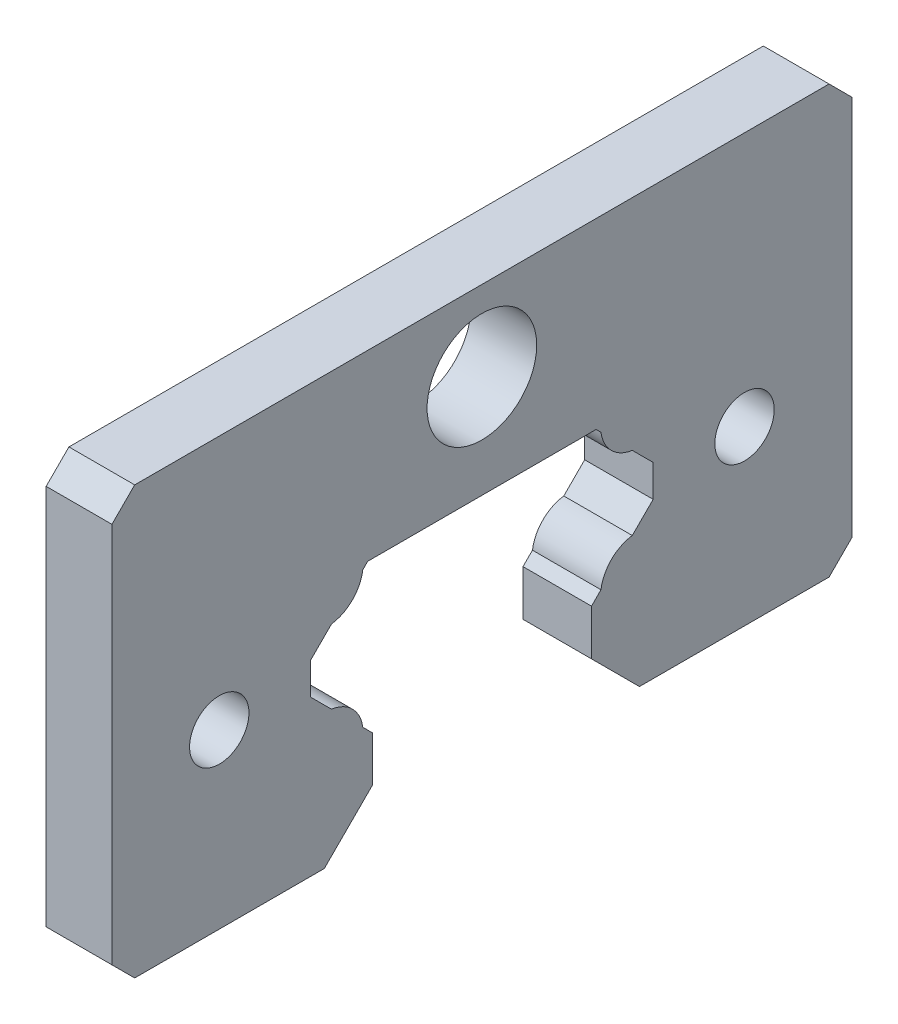
from build123d import *

# Parameters (mm, degrees)
EXTRUDE_1_DEPTH          = 1.5
EXTRUDE_1_DEPTH_BACK     = 1.5
CUT_EXTRUDE_1_DEPTH      = 1.5
CUT_EXTRUDE_1_DEPTH_BACK = 1.5
CUT_EXTRUDE_2_DEPTH      = 0.12
SKETCH_4_R               = 2.4
CUT_EXTRUDE_3_DEPTH      = 3
CUT_EXTRUDE_4_DEPTH      = 3
CUT_EXTRUDE_4_DEPTH_BACK = 3
SKETCH_5_R               = 1.3
CUT_EXTRUDE_5_DEPTH      = 3
CUT_EXTRUDE_5_DEPTH_BACK = 3
SKETCH_6_R               = 1.3


with BuildPart() as part:
    # Эскиз1 → Бобышка-Вытянуть1 (new, two sides: drawn at the far end of the back side and taken through both)
    with BuildSketch(Plane(origin=(0, 0, 0), x_dir=(0, 0, -1), z_dir=(1, 0, 0)).offset(-EXTRUDE_1_DEPTH_BACK)):
        Polygon((-16.2, 0.997020561), (-15.202979439, 0), (15.202979439, 0), (16.2, 0.997020561), (16.2, 17.702979439), (15.202979439, 18.7), (-15.202979439, 18.7), (-16.2, 17.702979439), align=None)
    extrude(amount=EXTRUDE_1_DEPTH + EXTRUDE_1_DEPTH_BACK)

    # Эскиз2 → Вырез-Вытянуть1 (cut, two sides: drawn at the far end of the back side and taken through both)
    with BuildSketch(Plane(origin=(0, 0, 0), x_dir=(0, 0, -1), z_dir=(1, 0, 0)).offset(-CUT_EXTRUDE_1_DEPTH_BACK)):
        with BuildLine():
            Line((-11.2, -4.3), (11.2, -4.3))
            Line((11.2, -4.3), (4.8, 2.1))
            Line((4.8, 2.1), (4.8, 4.1))
            Line((4.8, 4.1), (5.21443454, 4.51443454))
            ThreePointArc((5.21443454, 4.51443454), (5.66862915, 5.43137085), (6.58556546, 5.88556546))
            Line((6.58556546, 5.88556546), (7.5, 6.8))
            Line((7.5, 6.8), (7.5, 8.2))
            Line((7.5, 8.2), (6.58556546, 9.11443454))
            ThreePointArc((6.58556546, 9.11443454), (5.66862915, 9.56862915), (5.21443454, 10.48556546))
            Line((5.21443454, 10.48556546), (5, 10.7))
            Line((5, 10.7), (-5, 10.7))
            Line((-5, 10.7), (-5.21443454, 10.48556546))
            ThreePointArc((-5.21443454, 10.48556546), (-5.66862915, 9.56862915), (-6.58556546, 9.11443454))
            Line((-6.58556546, 9.11443454), (-7.5, 8.2))
            Line((-7.5, 8.2), (-7.5, 6.8))
            Line((-7.5, 6.8), (-6.58556546, 5.88556546))
            ThreePointArc((-6.58556546, 5.88556546), (-5.66862915, 5.43137085), (-5.21443454, 4.51443454))
            Line((-5.21443454, 4.51443454), (-4.8, 4.1))
            Line((-4.8, 4.1), (-4.8, 2.1))
            Line((-4.8, 2.1), (-11.2, -4.3))
        make_face()
    extrude(amount=CUT_EXTRUDE_1_DEPTH + CUT_EXTRUDE_1_DEPTH_BACK, mode=Mode.SUBTRACT)

    # Эскиз3 → Вырез-Вытянуть2 (cut)
    with BuildSketch(Plane(origin=(-1.5, 0, 0), x_dir=(0, 0, -1), z_dir=(1, 0, 0))):
        with BuildLine():
            Line((-16.2, -4.3), (-12.614213562, -4.3))
            Line((-12.614213562, -4.3), (-5.6, 2.714213562))
            Line((-5.6, 2.714213562), (-5.6, 3.76862915))
            Line((-5.6, 3.76862915), (-6.023597697, 4.192226848))
            ThreePointArc((-6.023597697, 4.192226848), (-6.375735931, 4.724264069), (-6.907773152, 5.076402303))
            Line((-6.907773152, 5.076402303), (-8.5, 6.66862915))
            Line((-8.5, 6.66862915), (-8.5, 8.33137085))
            Line((-8.5, 8.33137085), (-6.907773152, 9.923597697))
            ThreePointArc((-6.907773152, 9.923597697), (-6.375735931, 10.275735931), (-6.023597697, 10.807773152))
            Line((-6.023597697, 10.807773152), (-5.13137085, 11.7))
            Line((-5.13137085, 11.7), (5.13137085, 11.7))
            Line((5.13137085, 11.7), (6.023597697, 10.807773152))
            ThreePointArc((6.023597697, 10.807773152), (6.375735931, 10.275735931), (6.907773152, 9.923597697))
            Line((6.907773152, 9.923597697), (8.5, 8.33137085))
            Line((8.5, 8.33137085), (8.5, 6.66862915))
            Line((8.5, 6.66862915), (6.907773152, 5.076402303))
            ThreePointArc((6.907773152, 5.076402303), (6.375735931, 4.724264069), (6.023597697, 4.192226848))
            Line((6.023597697, 4.192226848), (5.6, 3.76862915))
            Line((5.6, 3.76862915), (5.6, 2.714213562))
            Line((5.6, 2.714213562), (12.614213562, -4.3))
            Line((12.614213562, -4.3), (16.2, -4.3))
            Line((16.2, -4.3), (16.2, 18.7))
            Line((16.2, 18.7), (-16.2, 18.7))
            Line((-16.2, 18.7), (-16.2, -4.3))
        make_face()
    extrude(amount=CUT_EXTRUDE_2_DEPTH, mode=Mode.SUBTRACT)

    # Эскиз4 → Вырез-Вытянуть3 (cut)
    with BuildSketch(Plane(origin=(-1.5, 0, 0), x_dir=(0, 0, -1), z_dir=(1, 0, 0))):
        with Locations((0, 15.2)):
            Circle(SKETCH_4_R)
    extrude(amount=CUT_EXTRUDE_3_DEPTH, mode=Mode.SUBTRACT)

    # Эскиз5 → Вырез-Вытянуть4 (cut, two sides: drawn at the far end of the back side and taken through both)
    with BuildSketch(Plane(origin=(0, 0, 0), x_dir=(0, 0, -1), z_dir=(1, 0, 0)).offset(-CUT_EXTRUDE_4_DEPTH_BACK)):
        with Locations((-11.5, 7.555556)):
            Circle(SKETCH_5_R)
    extrude(amount=CUT_EXTRUDE_4_DEPTH + CUT_EXTRUDE_4_DEPTH_BACK, mode=Mode.SUBTRACT)

    # Эскиз6 → Вырез-Вытянуть5 (cut, two sides: drawn at the far end of the back side and taken through both)
    with BuildSketch(Plane(origin=(0, 0, 0), x_dir=(0, 0, -1), z_dir=(1, 0, 0)).offset(-CUT_EXTRUDE_5_DEPTH_BACK)):
        with Locations((11.5, 7.555556)):
            Circle(SKETCH_6_R)
    extrude(amount=CUT_EXTRUDE_5_DEPTH + CUT_EXTRUDE_5_DEPTH_BACK, mode=Mode.SUBTRACT)


solid = part.part
